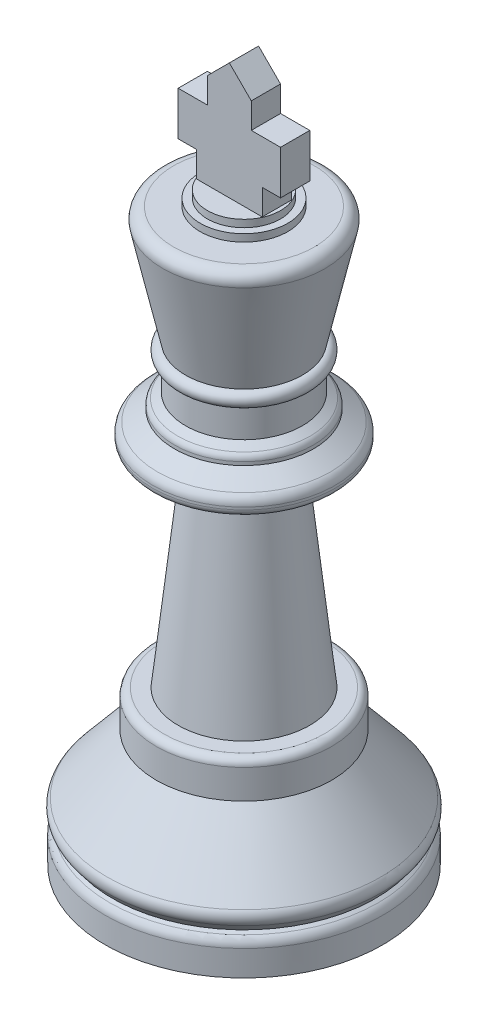
from build123d import *

# Parameters (mm, degrees)
BOSS_EXTRUDE1_DEPTH = 2
FILLET1_R           = 1.5
FILLET2_R           = 1


with BuildPart() as part:
    # Sketch1 → Revolve1 (revolve)
    with BuildSketch(Plane.XY):
        with BuildLine():
            Line((0, 0), (0, 80))
            Line((0, 80), (5, 80))
            Line((5, 80), (5, 79))
            Line((5, 79), (6, 79))
            Line((6, 79), (6, 78))
            Line((6, 78), (11.5, 78))
            Line((11.5, 78), (8, 62))
            ThreePointArc((8, 62), (9, 61), (8, 60))
            Line((8, 60), (8, 56))
            Line((8, 56), (9.5, 55))
            Line((9.5, 55), (9.5, 54))
            Line((9.5, 54), (12.5, 52))
            Line((12.5, 52), (12.5, 50))
            Line((12.5, 50), (6, 49))
            Line((6, 49), (9, 21))
            Line((9, 21), (12, 21))
            Line((12, 21), (12, 16))
            Line((12, 16), (19.5, 7))
            Line((19.5, 7), (18, 5))
            Line((18, 5), (19, 4.25))
            Line((19, 4.25), (19, 0))
            Line((19, 0), (0, 0))
        make_face()
    revolve(axis=Axis((0, 0, 0), (0, 1, 0)))

    # Sketch2 → Boss-Extrude1 (add, symmetric)
    with BuildSketch(Plane.XY):
        Polygon((0, 80), (0, 96), (3, 93), (3, 89.5), (7, 89.5), (7, 83.5), (4.5, 83.5), (4.5, 80), align=None)
    boss_extrude1 = extrude(amount=BOSS_EXTRUDE1_DEPTH, both=True)

    # Mirror1: Boss-Extrude1 across plane
    add(boss_extrude1.mirror(Plane(origin=(0, 80, -2), x_dir=(0, 0, 1), z_dir=(-1, 0, 0))))

    # Fillet1
    fillet1_edges = [part.edges().sort_by_distance(p)[0] for p in [
        (-19, 4.25, 0),
        (-19.5, 7, 0),
        (-12.5, 52, 0),
        (-11.5, 78, 0),
    ]]
    fillet(fillet1_edges, radius=FILLET1_R)

    # Fillet2
    fillet2_edges = [part.edges().sort_by_distance(p)[0] for p in [
        (-9.5, 55, 0),
        (-12.5, 50, 0),
        (-12, 21, 0),
    ]]
    fillet(fillet2_edges, radius=FILLET2_R)


solid = part.part
